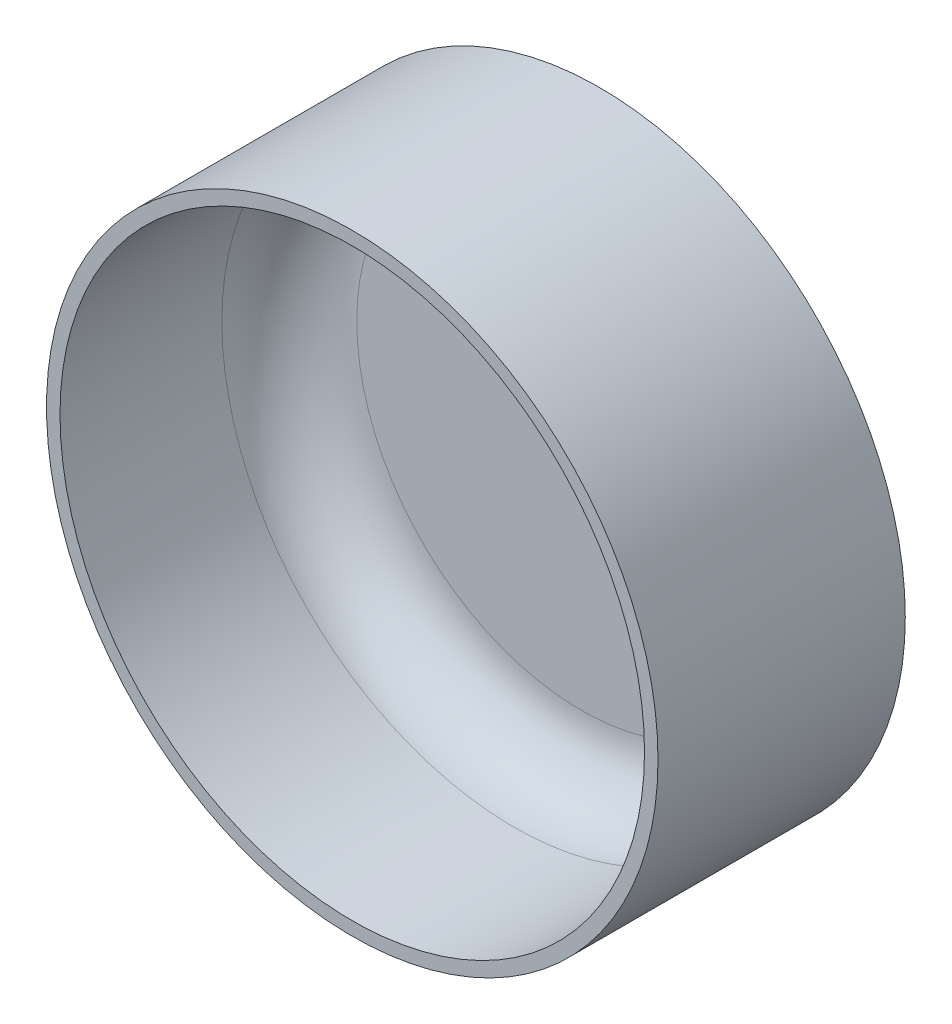
from build123d import *

# Parameters (mm, degrees)
SKETCH_1_R        = 68
SKETCH_1_R_2      = 65
EXTRUDE_1_DEPTH   = 55
SKETCH_2_R        = 68
EXTRUDE_1_2_DEPTH = 4
FILLET_1_R        = 15


with BuildPart() as part:
    # 草图1 → Extrude 1 (new body)
    with BuildSketch(Plane.XY):
        Circle(SKETCH_1_R)
        Circle(SKETCH_1_R_2, mode=Mode.SUBTRACT)
    extrude(amount=EXTRUDE_1_DEPTH)

    # 草图2 → Extrude 1 2 (add)
    with BuildSketch(Plane(origin=(0, 0, 0), x_dir=(-1, 0, 0), z_dir=(0, 0, -1))):
        with Locations(Location((0, 0, 0), (0, 0, 180))):
            Circle(SKETCH_2_R)
    extrude(amount=-EXTRUDE_1_2_DEPTH)

    # 圆角1
    fillet_1_edges = [part.edges().sort_by_distance(p)[0] for p in [
        (-65, 0, 4),
    ]]
    fillet(fillet_1_edges, radius=FILLET_1_R)


solid = part.part
